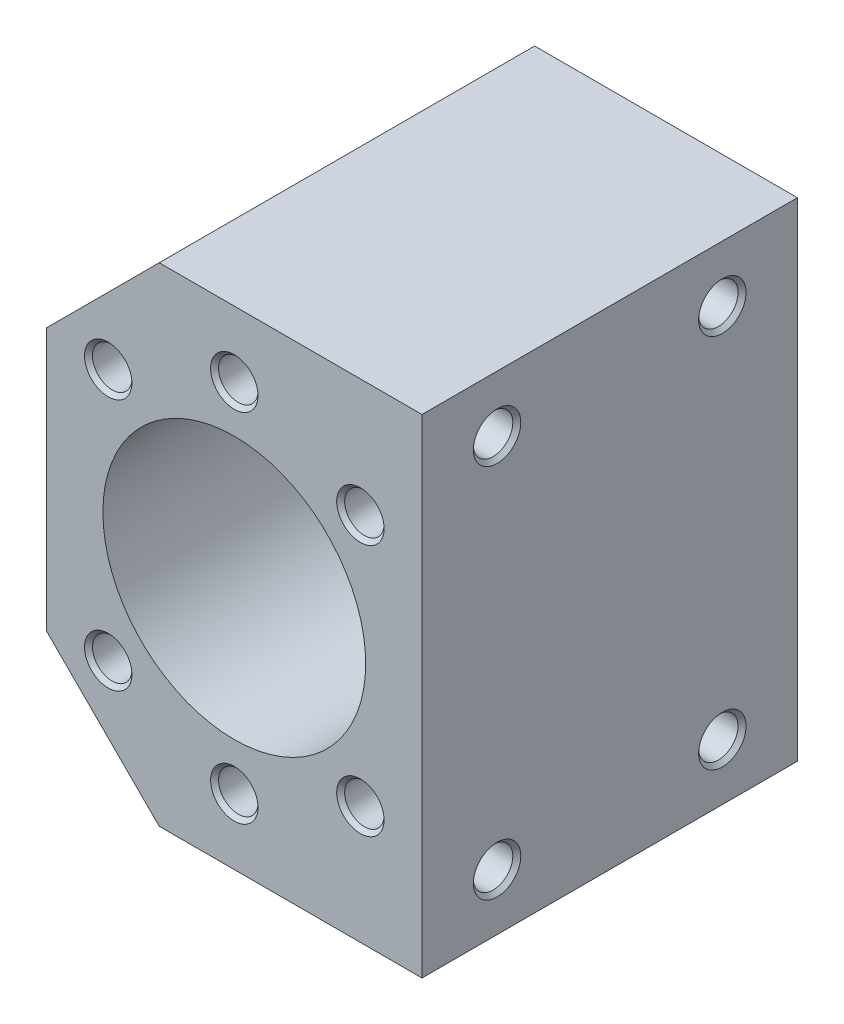
from build123d import *

# Parameters (mm, degrees)
SKETCH1_W                       = 40
SKETCH1_H                       = 52
SKETCH1_R                       = 14
BOSS_EXTRUDE1_DEPTH             = 20
M5X0_8_TAPPED_HOLE1_D           = 4.2
M5X0_8_TAPPED_HOLE1_DEPTH       = 10
M5X0_8_TAPPED_HOLE1_CSINK_D     = 5.05
M5X0_8_TAPPED_HOLE1_CSINK_ANGLE = 90
M5X0_8_TAPPED_HOLE1_TIP         = 1.2618073
CHAMFER1_SIZE                   = 12
M5X0_8_TAPPED_HOLE2_D           = 4.2
M5X0_8_TAPPED_HOLE2_DEPTH       = 12.4
M5X0_8_TAPPED_HOLE2_CSINK_D     = 5.05
M5X0_8_TAPPED_HOLE2_CSINK_ANGLE = 90
M5X0_8_TAPPED_HOLE2_TIP         = 1.2618073


with BuildPart() as part:
    # Sketch1 → Boss-Extrude1 (new, symmetric)
    with BuildSketch(Plane.XY):
        Rectangle(SKETCH1_W, SKETCH1_H)
        Circle(SKETCH1_R, mode=Mode.SUBTRACT)
    extrude(amount=BOSS_EXTRUDE1_DEPTH, both=True)

    # M5x0.8 Tapped Hole1
    with Locations(Plane.XY.offset(20)):
        with Locations((-13.435028843, 13.435028843), (0, 19), (13.435028843, 13.435028843), (13.435028843, -13.435028843), (0, -19), (-13.435028843, -13.435028843)):
            CounterSinkHole(M5X0_8_TAPPED_HOLE1_D / 2, M5X0_8_TAPPED_HOLE1_CSINK_D / 2, depth=M5X0_8_TAPPED_HOLE1_DEPTH, counter_sink_angle=M5X0_8_TAPPED_HOLE1_CSINK_ANGLE)
            with Locations((0, 0, -(M5X0_8_TAPPED_HOLE1_DEPTH + M5X0_8_TAPPED_HOLE1_TIP / 2))):  # 118° drill point
                Cone(0, M5X0_8_TAPPED_HOLE1_D / 2, M5X0_8_TAPPED_HOLE1_TIP, mode=Mode.SUBTRACT)

    # Chamfer1
    chamfer1_edges = [part.edges().sort_by_distance(p)[0] for p in [
        (-20, -26, 0),
        (-20, 26, 0),
    ]]
    chamfer(chamfer1_edges, length=CHAMFER1_SIZE)

    # M5x0.8 Tapped Hole2
    with Locations(Plane(origin=(20, 0, 0), x_dir=(0, 0, -1), z_dir=(1, 0, 0))):
        with Locations((-12, 20), (12, 20), (12, -20), (-12, -20)):
            CounterSinkHole(M5X0_8_TAPPED_HOLE2_D / 2, M5X0_8_TAPPED_HOLE2_CSINK_D / 2, depth=M5X0_8_TAPPED_HOLE2_DEPTH, counter_sink_angle=M5X0_8_TAPPED_HOLE2_CSINK_ANGLE)
            with Locations((0, 0, -(M5X0_8_TAPPED_HOLE2_DEPTH + M5X0_8_TAPPED_HOLE2_TIP / 2))):  # 118° drill point
                Cone(0, M5X0_8_TAPPED_HOLE2_D / 2, M5X0_8_TAPPED_HOLE2_TIP, mode=Mode.SUBTRACT)


solid = part.part
